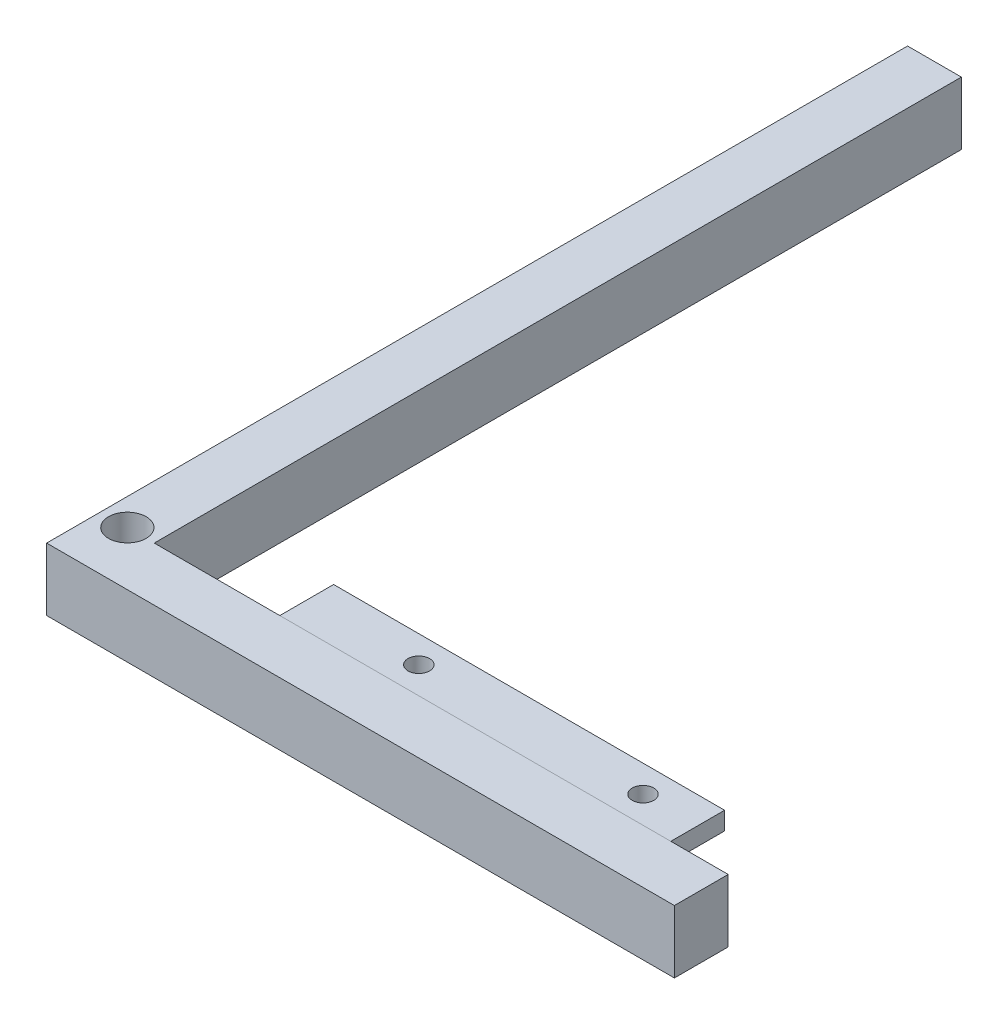
from build123d import *

# Parameters (mm, degrees)
EXTRUDE_1_DEPTH     = 3.5
SKETCH_2_W          = 1
SKETCH_2_H          = 41.8
SKETCH_2_W_2        = 32
SKETCH_2_H_2        = 1
CUT_EXTRUDE_1_DEPTH = 1.5
SKETCH_3_R          = 0.6
CUT_EXTRUDE_2_DEPTH = 50.807128004
SKETCH_3_4_R        = 1.05
CUT_EXTRUDE_5_DEPTH = 1.5
EXTRUDE_START       = -3.5
SKETCH_4_W          = 21.8
SKETCH_4_H          = 3
SKETCH_4_R          = 1
SKETCH_4_R_2        = 0.6
EXTRUDE_2_DEPTH     = 1


with BuildPart() as part:
    # 草图1 → 凸台-拉伸1 (new body)
    with BuildSketch(Plane(origin=(0, 0, 0), x_dir=(1, 0, 0), z_dir=(0, 1, 0))):
        Polygon((-17.5, -1.5), (17.5, -1.5), (17.5, 1.5), (-14.5, 1.5), (-14.5, 46.5), (-17.5, 46.5), align=None)
    extrude(amount=EXTRUDE_1_DEPTH)

    # 草图2 → 切除-拉伸1 (cut)
    with BuildSketch(Plane.XZ):
        with Locations((-16, -23.9)):
            Rectangle(SKETCH_2_W, SKETCH_2_H)
        Rectangle(SKETCH_2_W_2, SKETCH_2_H_2)
    extrude(amount=-CUT_EXTRUDE_1_DEPTH, mode=Mode.SUBTRACT)

    # 草图3 → 切除-拉伸2 (cut, through all)
    with BuildSketch(Plane(origin=(0, 3.5, 0), x_dir=(1, 0, 0), z_dir=(0, 1, 0))):
        with Locations(Location((-16, 1.5, 0), (0, 0, 270))):
            Circle(SKETCH_3_R)
    extrude(amount=-CUT_EXTRUDE_2_DEPTH, mode=Mode.SUBTRACT)

    # 草图3<4> → 切除-拉伸5 (cut)
    with BuildSketch(Plane(origin=(0, 3.5, 0), x_dir=(1, 0, 0), z_dir=(0, 1, 0))):
        with Locations(Location((-16, 1.5, 0), (0, 0, 270))):
            Circle(SKETCH_3_4_R)
    extrude(amount=-CUT_EXTRUDE_5_DEPTH, mode=Mode.SUBTRACT)


with BuildPart() as body_2:
    # 草图4 → 凸台-拉伸2 (new body)
    # profile 1 of 3: a face of its own
    with BuildSketch(Plane.XZ.offset(EXTRUDE_START)):
        with Locations((3.4, -3)):
            Rectangle(SKETCH_4_W, SKETCH_4_H)
        with Locations((-1.25, -3.000000894)):
            Circle(SKETCH_4_R, mode=Mode.SUBTRACT)
        with Locations((11.25, -3.000000894)):
            Circle(SKETCH_4_R, mode=Mode.SUBTRACT)
    # profile 2 of 3: a face of its own
    with BuildSketch(Plane.XZ.offset(EXTRUDE_START)):
        with Locations((-1.25, -3.000000894)):
            Circle(SKETCH_4_R)
        with Locations(Location((-1.25, -3.000000894, 0), (0, 0, 270))):
            Circle(SKETCH_4_R_2, mode=Mode.SUBTRACT)
    # profile 3 of 3: a face of its own
    with BuildSketch(Plane.XZ.offset(EXTRUDE_START)):
        with Locations((11.25, -3.000000894)):
            Circle(SKETCH_4_R)
        with Locations(Location((11.25, -3.000000894, 0), (0, 0, 270))):
            Circle(SKETCH_4_R_2, mode=Mode.SUBTRACT)
    extrude(amount=EXTRUDE_2_DEPTH)


solid = Compound([part.part, body_2.part])
